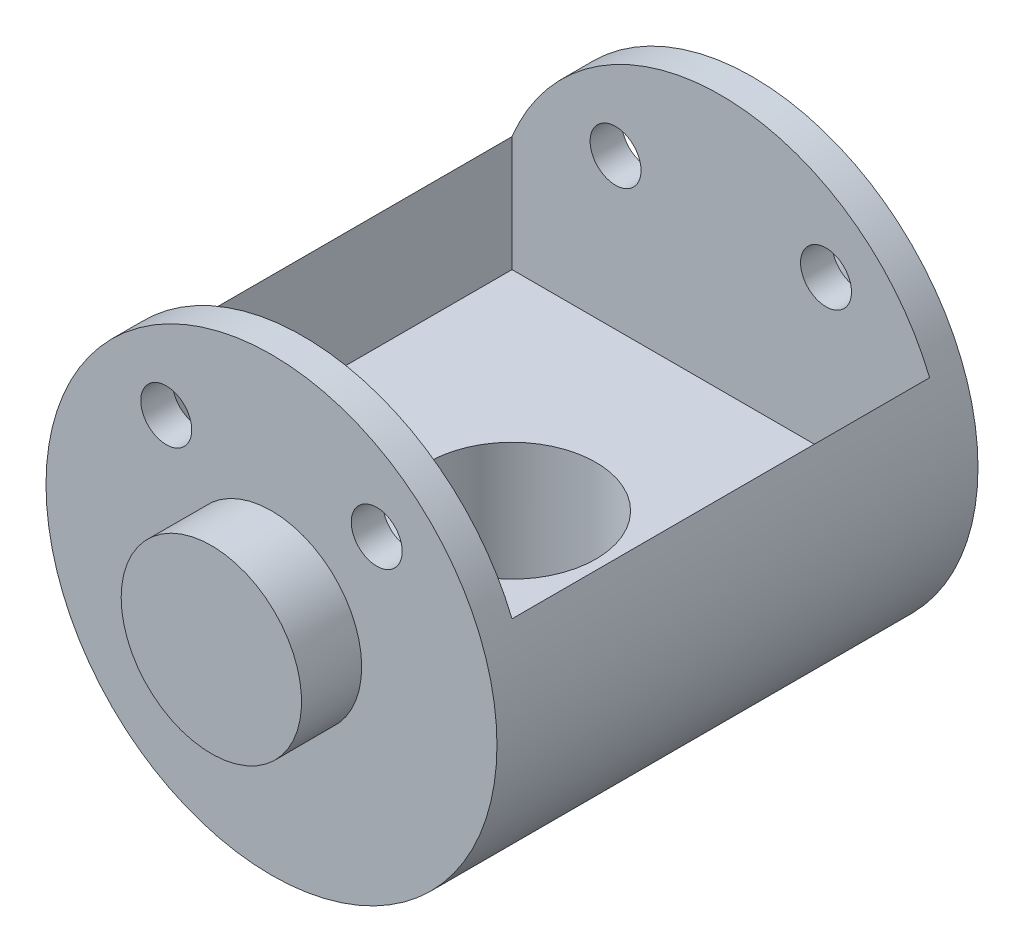
from build123d import *

# Parameters (mm, degrees)
SKETCH2_R             = 19.05
EXTRUDE1_DEPTH        = 20.32
SKETCH4_W             = 35.2806
SKETCH4_H             = 35.2806
EXTRUDE2_DEPTH        = 21.59
SKETCH5_R             = 7.0866
EXTRUDE3_DEPTH        = 36.241069791
SKETCH7_R             = 7.62
EXTRUDE4_DEPTH        = 5.08
F_8_CLEARANCE_HOLE1_D = 4.3053


with BuildPart() as part:
    # Sketch2 → Extrude1 (new, symmetric)
    with BuildSketch(Plane.XY):
        Circle(SKETCH2_R)
    extrude(amount=EXTRUDE1_DEPTH, both=True)

    # Sketch4 → Extrude2 (cut)
    with BuildSketch(Plane(origin=(0, 19.05, 20.32), x_dir=(-1, 0, 0), z_dir=(0, 1, 0))):
        with Locations((0, -20.32)):
            Rectangle(SKETCH4_W, SKETCH4_H)
    extrude(amount=-EXTRUDE2_DEPTH, mode=Mode.SUBTRACT)

    # Sketch5 → Extrude3 (cut, through all)
    with BuildSketch(Plane(origin=(0, -2.54, 0), x_dir=(1, 0, 0), z_dir=(0, 1, 0))):
        with Locations(Location((0, 0, 0), (0, 0, 270))):
            Circle(SKETCH5_R)
    extrude(amount=-EXTRUDE3_DEPTH, mode=Mode.SUBTRACT)

    # Sketch7 → Extrude4 (add)
    with BuildSketch(Plane(origin=(0, 0, -20.32), x_dir=(-1, 0, 0), z_dir=(0, 0, -1))):
        with Locations(Location((0, 0, 0), (0, 0, 180))):
            Circle(SKETCH7_R)
    extrude4 = extrude(amount=EXTRUDE4_DEPTH)

    # Mirror1: Extrude4 across plane
    add(extrude4.mirror(Plane.XY))

    # #8 Clearance Hole1 (through all)
    with Locations(Plane(origin=(0, 0, -20.32), x_dir=(-1, 0, 0), z_dir=(0, 0, -1))):
        with Locations((-8.89, 10.16), (8.89, 10.16)):
            Hole(F_8_CLEARANCE_HOLE1_D / 2)


solid = part.part
